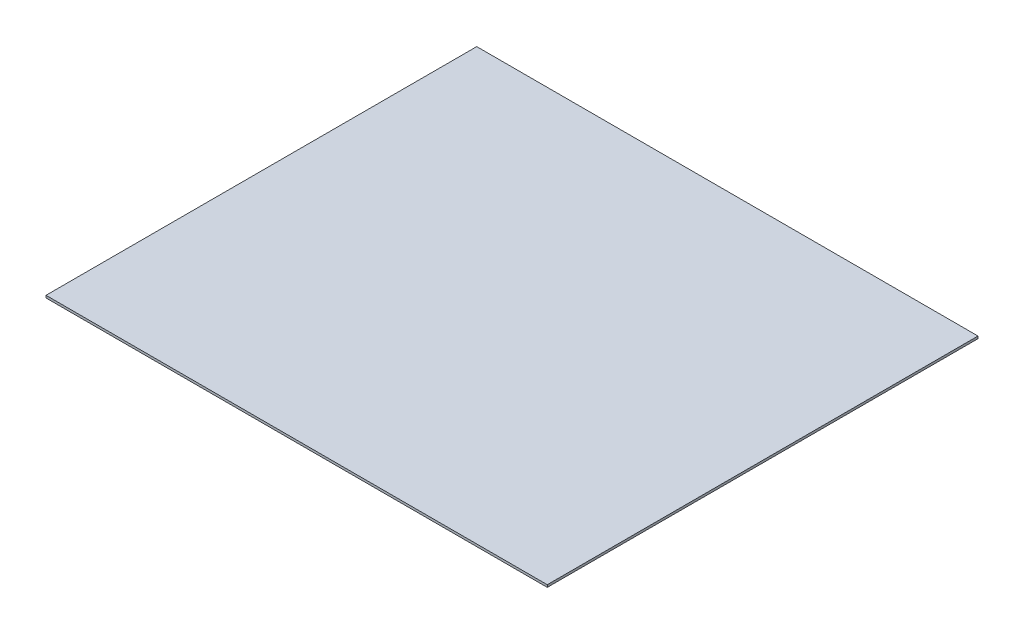
from build123d import *

# Parameters (mm, degrees)
CROQUIS1_W     = 1073
CROQUIS1_H     = 922
EXTRUIR1_DEPTH = 5


with BuildPart() as part:
    # Croquis1 → Extruir1 (new body)
    with BuildSketch(Plane(origin=(0, 0, 0), x_dir=(1, 0, 0), z_dir=(0, 1, 0))):
        Rectangle(CROQUIS1_W, CROQUIS1_H)
    extrude(amount=EXTRUIR1_DEPTH)


solid = part.part
